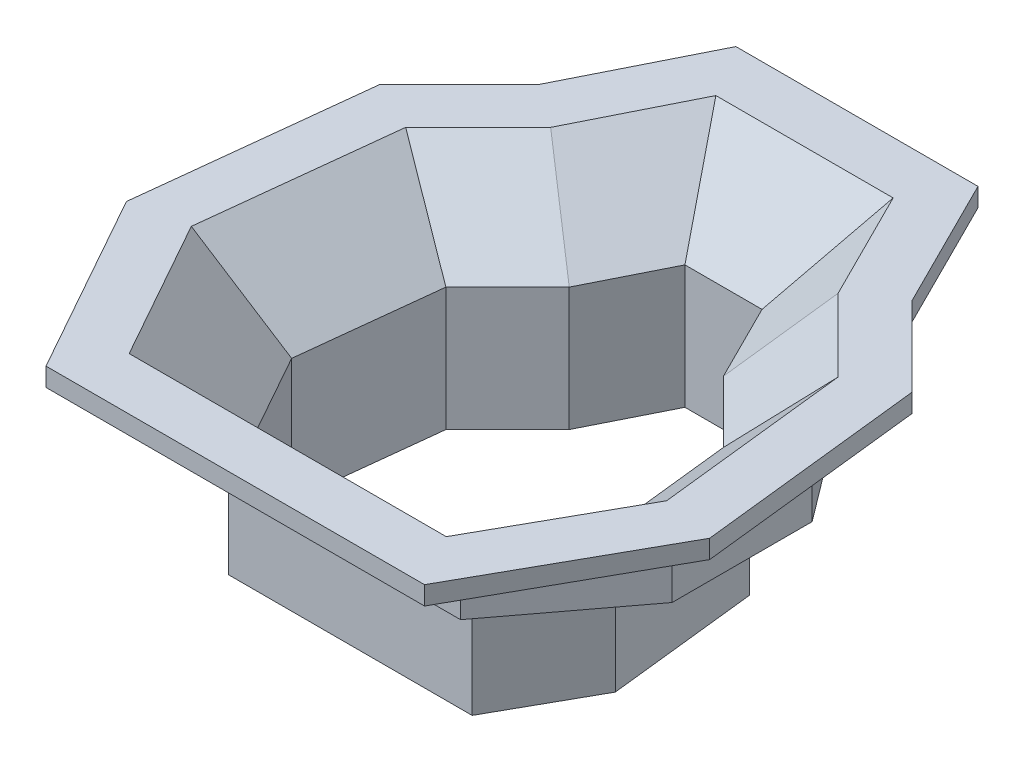
from build123d import *

# Parameters (mm, degrees)
BOSS_EXTRUDE3_DEPTH  = 4
BOSS_EXTRUDE30_DEPTH = 2.1
CUT_EXTRUDE23_DEPTH  = 19.67655379
CUT_EXTRUDE24_DEPTH  = 18.444111581


with BuildPart() as part:
    # Sketch3<4> → Boss-Extrude3 (new body)
    with BuildSketch(Plane(origin=(0, 0.5, 0), x_dir=(1, 0, 0), z_dir=(0, 1, 0))):
        Polygon((5.617596648, 2.37486125), (5.073087868, 7.275440269), (2.993112649, 9.355415488), (1.620820393, 12.1), (-1.620820393, 12.1), (-2.993112649, 9.355415488), (-5.073087868, 7.275440269), (-5.617596648, 2.37486125), (-3.951674234, -0.6), (3.951674234, -0.6), align=None)
        Polygon((-4.5, 7), (-5, 2.5), (-3.599999905, 0), (3.599999905, 0), (5, 2.5), (4.5, 7), (2.5, 9), (1.25, 11.5), (-1.25, 11.5), (-2.5, 9), align=None, mode=Mode.SUBTRACT)
    extrude(amount=-BOSS_EXTRUDE3_DEPTH)

    # Sketch57 → Boss-Extrude30 (add)
    with BuildSketch(Plane(origin=(0, 0.5, 0), x_dir=(1, 0, 0), z_dir=(0, 1, 0))):
        Polygon((-8.022942498, 6.351803212), (-8.022942498, 1.811803212), (-5.075187344, -2.1), (5.075187344, -2.1), (8.022942498, 1.811803212), (8.022942498, 6.351803212), (5.075187344, 10.263606425), (-5.075187344, 10.263606425), align=None)
    extrude(amount=BOSS_EXTRUDE30_DEPTH)

    # Sweep3: sweep along a path in Sketch3
    with BuildLine(Plane(origin=(0, 0.5, 0), x_dir=(1, 0, 0), z_dir=(0, 1, 0))) as sweep3_path:
        Line((-4.5, 7), (-5, 2.5))
        Line((-5, 2.5), (-3.599999905, 0))
        Line((-3.599999905, 0), (3.599999905, 0))
        Line((3.599999905, 0), (5, 2.5))
        Line((5, 2.5), (4.5, 7))
        Line((4.5, 7), (2.5, 9))
        Line((2.5, 9), (1.25, 11.5))
        Line((1.25, 11.5), (-1.25, 11.5))
        Line((-1.25, 11.5), (-2.5, 9))
        Line((-2.5, 9), (-4.5, 7))
    # Sketch4 → Sweep3 (sweep)
    with BuildSketch(Plane(origin=(0, 0, 0), x_dir=(0, 0, -1), z_dir=(1, 0, 0))):
        Polygon((0, 0.5), (-0.6, 0.5), (-2.62762332, 2.52762332), (-4.32762332, 2.52762332), (-4.32762332, 3.12762332), (-2.62762332, 3.12762332), align=None)
    sweep(path=sweep3_path.line, transition=Transition.RIGHT)

    # Cut-Sweep10: sweep along a path in Sketch61
    with BuildLine(Plane(origin=(0, 0.5, 0), x_dir=(1, 0, 0), z_dir=(0, 1, 0))) as cut_sweep10_path:
        Line((1.25, 11.5), (2.5, 9))
        Line((2.5, 9), (4.5, 7))
        Line((4.5, 7), (5, 2.5))
        Line((5, 2.5), (3.599999905, 0))
        Line((3.599999905, 0), (-3.599999905, 0))
        Line((-3.599999905, 0), (-5, 2.5))
        Line((-5, 2.5), (-4.5, 7))
        Line((-4.5, 7), (-2.5, 9))
        Line((-2.5, 9), (-1.25, 11.5))
        Line((-1.25, 11.5), (1.25, 11.5))
    # Sketch60 → Cut-Sweep10 (sweep, cut)
    with BuildSketch(Plane(origin=(0, 0, 0), x_dir=(0, 0, -1), z_dir=(1, 0, 0))):
        Polygon((-4.32762332, 3.12762332), (-2.62762332, 3.12762332), (0, 0.5), (0.419943975, 0.080056025), (0.419943975, 3.72762332), (0, 3.72762332), (-4.32762332, 3.72762332), align=None)
    sweep(path=cut_sweep10_path.line, transition=Transition.RIGHT, mode=Mode.SUBTRACT)


with BuildPart() as cut_sweep10_kept_piece:
    # of the separate pieces the step leaves, the one the design keeps (cut_sweep10_pieces_kept)
    add(part.part.solids().sort_by_distance((5.617596648, 0.5, -2.37486125))[0])

    # Sketch62 → Cut-Extrude23 (cut, symmetric)
    with BuildSketch(Plane(origin=(0.147112643, 0, -0.195225071), x_dir=(0, -1, 0), z_dir=(0.6018150231520525, 0, -0.7986355100472898))):
        Polygon((-2.52762332, 10.230017371), (-2.52762332, 11.230017371), (-0.5, 11.230017371), (-0.5, 10.230017371), (-0.96381166, 9.766205711), (-2.06381166, 9.766205711), align=None)
    extrude(amount=CUT_EXTRUDE23_DEPTH, both=True, mode=Mode.SUBTRACT)

    # Sketch64 → Cut-Extrude24 (cut, symmetric)
    with BuildSketch(Plane(origin=(-3.776568435, 0, -5.011675586), x_dir=(0, -1, 0), z_dir=(-0.6018150231520465, 0, -0.7986355100472943))):
        Polygon((-2.52762332, 5.317036382), (-2.52762332, 6.317036382), (-0.5, 6.317036382), (-0.5, 5.317036382), (-0.96381166, 4.853224722), (-2.06381166, 4.853224722), align=None)
    extrude(amount=CUT_EXTRUDE24_DEPTH, both=True, mode=Mode.SUBTRACT)


solid = cut_sweep10_kept_piece.part
